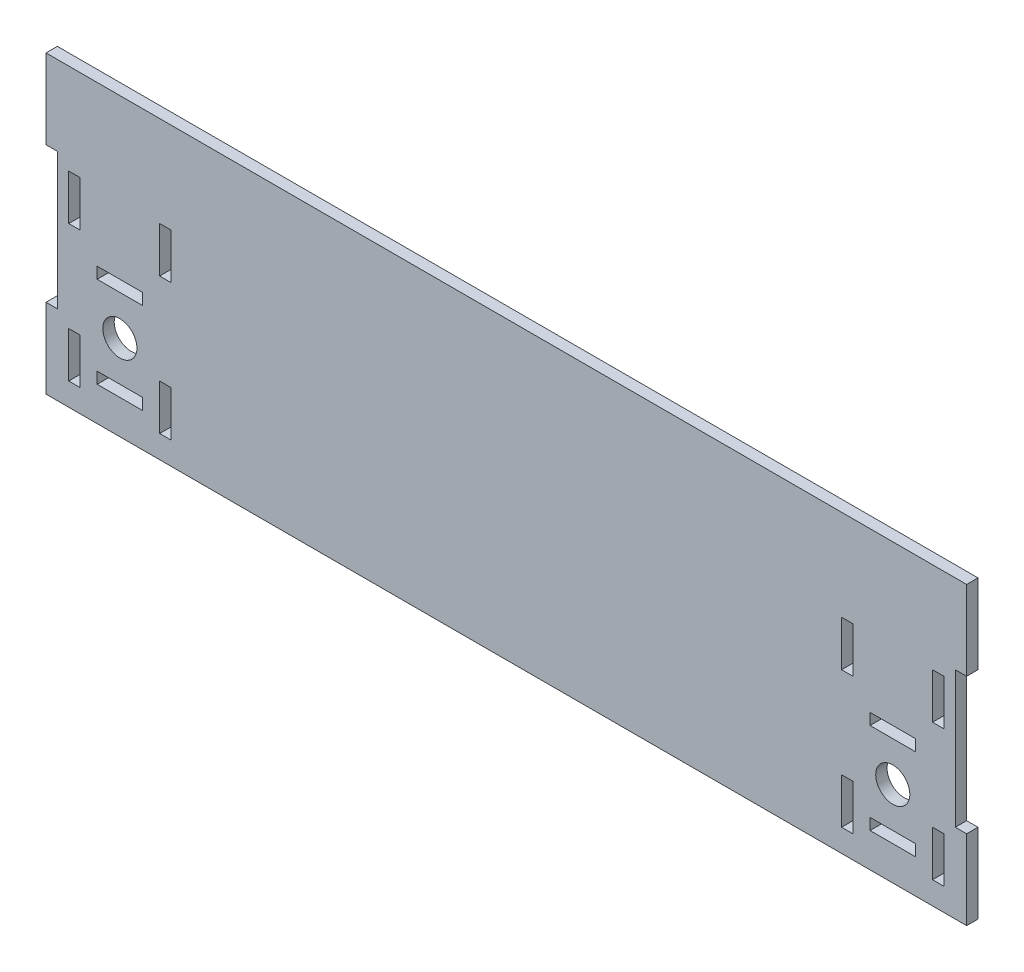
from build123d import *

# Parameters (mm, degrees)
SKETCH1_W           = 405
SKETCH1_H           = 130
BOSS_EXTRUDE1_DEPTH = 5
SKETCH2_W           = 5
SKETCH2_H           = 60
CUT_EXTRUDE1_DEPTH  = 5
SKETCH3_W           = 5
SKETCH3_H           = 20
CUT_EXTRUDE2_DEPTH  = 10
SKETCH4_W           = 20
SKETCH4_H           = 5
CUT_EXTRUDE3_DEPTH  = 10
SKETCH5_R           = 7.5
CUT_EXTRUDE4_DEPTH  = 10


with BuildPart() as part:
    # Sketch1 → Boss-Extrude1 (new body)
    with BuildSketch(Plane.XY):
        with Locations((-202.5, -65)):
            Rectangle(SKETCH1_W, SKETCH1_H)
    extrude(amount=BOSS_EXTRUDE1_DEPTH)

    # Sketch2 → Cut-Extrude1 (cut)
    with BuildSketch(Plane(origin=(0, 0, 0), x_dir=(-1, 0, 0), z_dir=(0, 0, -1))):
        with Locations((402.5, -65)):
            Rectangle(SKETCH2_W, SKETCH2_H)
        with Locations((2.5, -65)):
            Rectangle(SKETCH2_W, SKETCH2_H)
    extrude(amount=-CUT_EXTRUDE1_DEPTH, mode=Mode.SUBTRACT)

    # Sketch3 → Cut-Extrude2 (cut)
    with BuildSketch(Plane.XY.offset(5)):
        with Locations((-392.5, -110)):
            Rectangle(SKETCH3_W, SKETCH3_H)
        with Locations((-392.5, -50)):
            Rectangle(SKETCH3_W, SKETCH3_H)
        with Locations((-352.5, -50)):
            Rectangle(SKETCH3_W, SKETCH3_H)
        with Locations((-352.5, -110)):
            Rectangle(SKETCH3_W, SKETCH3_H)
        with Locations((-52.5, -110)):
            Rectangle(SKETCH3_W, SKETCH3_H)
        with Locations((-52.5, -50)):
            Rectangle(SKETCH3_W, SKETCH3_H)
        with Locations((-12.5, -50)):
            Rectangle(SKETCH3_W, SKETCH3_H)
        with Locations((-12.5, -110)):
            Rectangle(SKETCH3_W, SKETCH3_H)
    extrude(amount=-CUT_EXTRUDE2_DEPTH, mode=Mode.SUBTRACT)

    # Sketch4 → Cut-Extrude3 (cut)
    with BuildSketch(Plane.XY.offset(5)):
        with Locations((-372.5, -112.5)):
            Rectangle(SKETCH4_W, SKETCH4_H)
        with Locations((-372.5, -72.5)):
            Rectangle(SKETCH4_W, SKETCH4_H)
        with Locations((-32.5, -112.5)):
            Rectangle(SKETCH4_W, SKETCH4_H)
        with Locations((-32.5, -72.5)):
            Rectangle(SKETCH4_W, SKETCH4_H)
    extrude(amount=-CUT_EXTRUDE3_DEPTH, mode=Mode.SUBTRACT)

    # Sketch5 → Cut-Extrude4 (cut)
    with BuildSketch(Plane.XY.offset(5)):
        with Locations((-372.5, -92.5)):
            Circle(SKETCH5_R)
        with Locations(Location((-32.5, -92.5, 0), (0, 0, 180))):
            Circle(SKETCH5_R)
    extrude(amount=-CUT_EXTRUDE4_DEPTH, mode=Mode.SUBTRACT)


solid = part.part
